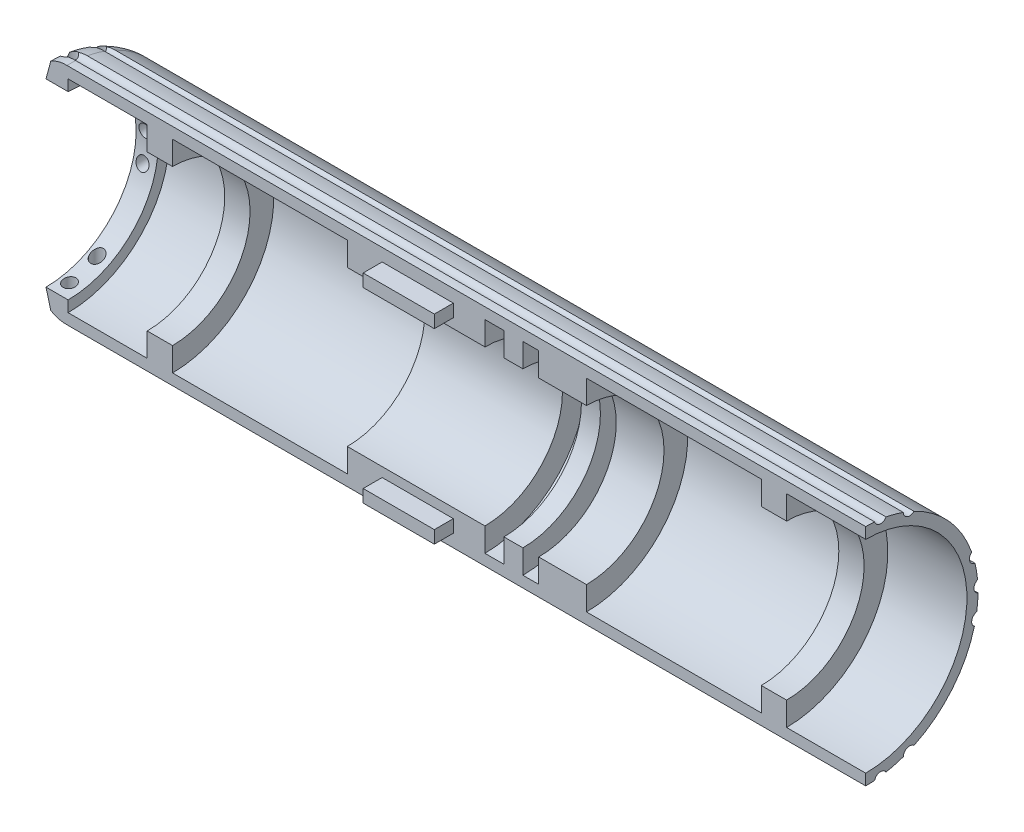
from build123d import *

# Parameters (mm, degrees)
REVOLVE1_ANGLE      = 180
SKETCH4_R           = 0.4
CUT_EXTRUDE2_DEPTH  = 18
CUT_EXTRUDE3_START  = 40
SKETCH4_2_R         = 0.4
CUT_EXTRUDE3_DEPTH  = 40
SKETCH5_W           = 0.4
SKETCH5_H           = 3
SKETCH6_W           = 0.4
SKETCH6_H           = 3.684478834
SKETCH7_W           = 3.163259876
SKETCH7_H           = 0.4
SKETCH8_W           = 2.90051453
SKETCH8_H           = 0.4
SKETCH9_W           = 0.4
SKETCH9_H           = 3.399978776
SKETCH10_W          = 0.4
SKETCH10_H          = 4.423489113
SKETCH11_W          = 3.4047897
SKETCH11_H          = 0.4
SKETCH3_W           = 4.5
SKETCH3_H           = 0.8
BOSS_EXTRUDE1_DEPTH = 1.2


with BuildPart() as part:
    # Sketch1 → Revolve1 (revolve)
    with BuildSketch(Plane.XY):
        with BuildLine():
            Line((-17.15876881, 0), (33.33964676, 0))
            Line((33.33964676, 0), (33.33964676, 0.7))
            Line((33.33964676, 0.7), (28.33964676, 0.7))
            Line((28.33964676, 0.7), (28.33964676, 2.2))
            Line((28.33964676, 2.2), (26.73964676, 2.2))
            Line((26.73964676, 2.2), (26.73964676, 0.7))
            Line((26.73964676, 0.7), (15.68964676, 0.7))
            Line((15.68964676, 0.7), (15.68964676, 2.2))
            Line((15.68964676, 2.2), (12.66964676, 2.2))
            Line((12.66964676, 2.2), (12.66964676, 0.7))
            Line((12.66964676, 0.7), (11.66964676, 0.7))
            Line((11.66964676, 0.7), (11.66964676, 2.2))
            Line((11.66964676, 2.2), (10.46964676, 2.2))
            Line((10.46964676, 2.2), (10.46964676, 0.7))
            Line((10.46964676, 0.7), (9.26964676, 0.7))
            Line((9.26964676, 0.7), (9.26964676, 2.2))
            Line((9.26964676, 2.2), (0.56964676, 2.2))
            Line((0.56964676, 2.2), (0.56964676, 0.7))
            Line((0.56964676, 0.7), (-10.48035324, 0.7))
            Line((-10.48035324, 0.7), (-10.48035324, 2.2))
            Line((-10.48035324, 2.2), (-12.08035324, 2.2))
            Line((-12.08035324, 2.2), (-12.08035324, 0.7))
            Line((-12.08035324, 0.7), (-17.08035324, 0.7))
            Line((-17.08035324, 0.7), (-17.08035324, 1.4))
            Line((-17.08035324, 1.4), (-18.48035324, 1.4))
            Line((-18.48035324, 1.4), (-18.18035324, 0.280384758))
            ThreePointArc((-18.18035324, 0.280384758), (-17.690655048, 0.063336112), (-17.15876881, 0))
        make_face()
    revolve(axis=Axis((-19.05, 7.1, 0), (1, 0, 0)), revolution_arc=REVOLVE1_ANGLE)

    # Sketch4 → Cut-Extrude2 (cut)
    with BuildSketch(Plane(origin=(0, 0, 0), x_dir=(0, 0, -1), z_dir=(1, 0, 0))):
        with Locations((0.946314894, 14.287975245)):
            Circle(SKETCH4_R)
        with Locations((7.099940231, 5.63257071)):
            Circle(SKETCH4_R)
        with Locations((2.774454885, 13.798126611)):
            Circle(SKETCH4_R)
        with Locations((6.957791458, 9.137556876)):
            Circle(SKETCH4_R)
        with Locations((7.244044938, 7.39379063)):
            Circle(SKETCH4_R)
        with Locations((2.774454885, 0.401873389)):
            Circle(SKETCH4_R)
        with Locations((0.946314894, -0.087975245)):
            Circle(SKETCH4_R)
    extrude(amount=-CUT_EXTRUDE2_DEPTH, mode=Mode.SUBTRACT)

    # Sketch4<2> → Cut-Extrude3 (cut)
    with BuildSketch(Plane(origin=(0, 0, 0), x_dir=(0, 0, -1), z_dir=(1, 0, 0)).offset(CUT_EXTRUDE3_START)):
        with Locations((0.946314894, 14.287975245)):
            Circle(SKETCH4_2_R)
        with Locations((7.099940231, 5.63257071)):
            Circle(SKETCH4_2_R)
        with Locations((2.774454885, 13.798126611)):
            Circle(SKETCH4_2_R)
        with Locations((6.957791458, 9.137556876)):
            Circle(SKETCH4_2_R)
        with Locations((7.244044938, 7.39379063)):
            Circle(SKETCH4_2_R)
        with Locations((2.774454885, 0.401873389)):
            Circle(SKETCH4_2_R)
        with Locations((0.946314894, -0.087975245)):
            Circle(SKETCH4_2_R)
    extrude(amount=-CUT_EXTRUDE3_DEPTH, mode=Mode.SUBTRACT)

    # Sketch5 → Cut-Revolve1 (revolve, cut)
    with BuildSketch(Plane.ZY.offset(17.9)):
        with Locations((-0.713364876, 13.192171173)):
            Rectangle(SKETCH5_W, SKETCH5_H)
    revolve(axis=Axis((-17.9, 11.692171173, -0.913364876), (0, 1, 0)), mode=Mode.SUBTRACT)

    # Sketch6 → Cut-Revolve2 (revolve, cut)
    with BuildSketch(Plane.ZY.offset(17.9)):
        with Locations((-2.477850321, 12.742837522)):
            Rectangle(SKETCH6_W, SKETCH6_H)
    revolve(axis=Axis((-17.9, 10.900598105, -2.677850321), (0, 1, 0)), mode=Mode.SUBTRACT)

    # Sketch7 → Cut-Revolve3 (revolve, cut)
    with BuildSketch(Plane.ZY.offset(17.9)):
        with Locations((-6.042052302, 8.844895939)):
            Rectangle(SKETCH7_W, SKETCH7_H)
    revolve(axis=Axis((-17.9, 9.044895939, -6.641375517), (0, 0, 1)), mode=Mode.SUBTRACT)

    # Sketch8 → Cut-Revolve4 (revolve, cut)
    with BuildSketch(Plane.ZY.offset(17.9)):
        with Locations((-6.205859823, 7.6)):
            Rectangle(SKETCH8_W, SKETCH8_H)
    revolve(axis=Axis((-17.9, 7.4, -7.656117088), (0, 0, 1)), mode=Mode.SUBTRACT)

    # Sketch9 → Cut-Revolve5 (revolve, cut)
    with BuildSketch(Plane.ZY.offset(17.9)):
        with Locations((-2.848282412, 1.934281854)):
            Rectangle(SKETCH9_W, SKETCH9_H)
    revolve(axis=Axis((-17.9, 0.706480684, -2.648282412), (0, 1, 0)), mode=Mode.SUBTRACT)

    # Sketch10 → Cut-Revolve6 (revolve, cut)
    with BuildSketch(Plane.ZY.offset(17.9)):
        with Locations((-1.103279813, 2.211744557)):
            Rectangle(SKETCH10_W, SKETCH10_H)
    revolve(axis=Axis((-17.9, 0.238908647, -0.903279813), (0, 1, 0)), mode=Mode.SUBTRACT)

    # Sketch11 → Cut-Revolve7 (revolve, cut)
    with BuildSketch(Plane.ZY.offset(17.9)):
        with Locations((-5.965359813, 5.899304245)):
            Rectangle(SKETCH11_W, SKETCH11_H)
    revolve(axis=Axis((-17.9, 5.699304245, -6.777059862), (0, 0, 1)), mode=Mode.SUBTRACT)

    # Sketch3 → Boss-Extrude1 (add)
    with BuildSketch(Plane.XY):
        with Locations((5.01964676, 13)):
            Rectangle(SKETCH3_W, SKETCH3_H)
        with Locations((5.01964676, 1.2)):
            Rectangle(SKETCH3_W, SKETCH3_H)
    extrude(amount=BOSS_EXTRUDE1_DEPTH)


solid = part.part
